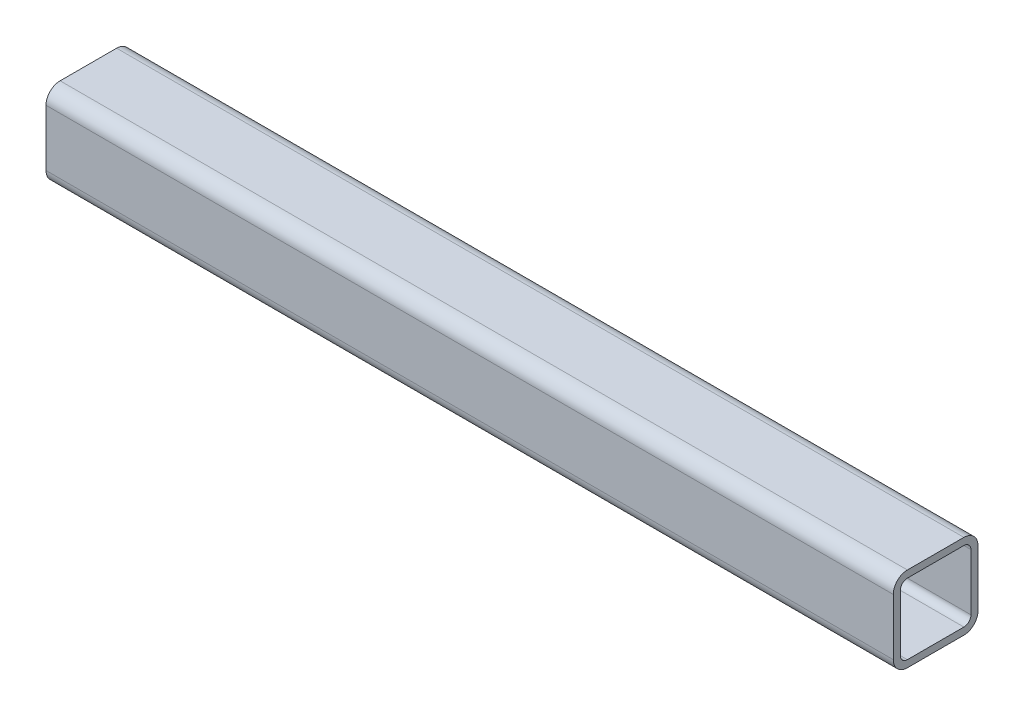
from build123d import *

# Parameters (mm, degrees)
STRUCTURAL_MEMBER1_DEPTH = 762


with BuildPart() as part:
    # Sketch1 → Structural Member1 (new body)
    with BuildSketch(Plane.ZY):
        with BuildLine():
            Line((-25.4, -38.1), (25.4, -38.1))
            ThreePointArc((25.4, -38.1), (34.380256121, -34.380256121), (38.1, -25.4))
            Line((38.1, -25.4), (38.1, 25.4))
            ThreePointArc((38.1, 25.4), (34.380256121, 34.380256121), (25.4, 38.1))
            Line((25.4, 38.1), (-25.4, 38.1))
            ThreePointArc((-25.4, 38.1), (-34.380256121, 34.380256121), (-38.1, 25.4))
            Line((-38.1, 25.4), (-38.1, -25.4))
            ThreePointArc((-38.1, -25.4), (-34.380256121, -34.380256121), (-25.4, -38.1))
        make_face()
        with BuildLine():
            Line((-25.4, -31.75), (25.4, -31.75))
            ThreePointArc((25.4, -31.75), (29.890128061, -29.890128061), (31.75, -25.4))
            Line((31.75, -25.4), (31.75, 25.4))
            ThreePointArc((31.75, 25.4), (29.890128061, 29.890128061), (25.4, 31.75))
            Line((25.4, 31.75), (-25.4, 31.75))
            ThreePointArc((-25.4, 31.75), (-29.890128061, 29.890128061), (-31.75, 25.4))
            Line((-31.75, 25.4), (-31.75, -25.4))
            ThreePointArc((-31.75, -25.4), (-29.890128061, -29.890128061), (-25.4, -31.75))
        make_face(mode=Mode.SUBTRACT)
    extrude(amount=STRUCTURAL_MEMBER1_DEPTH)


solid = part.part
